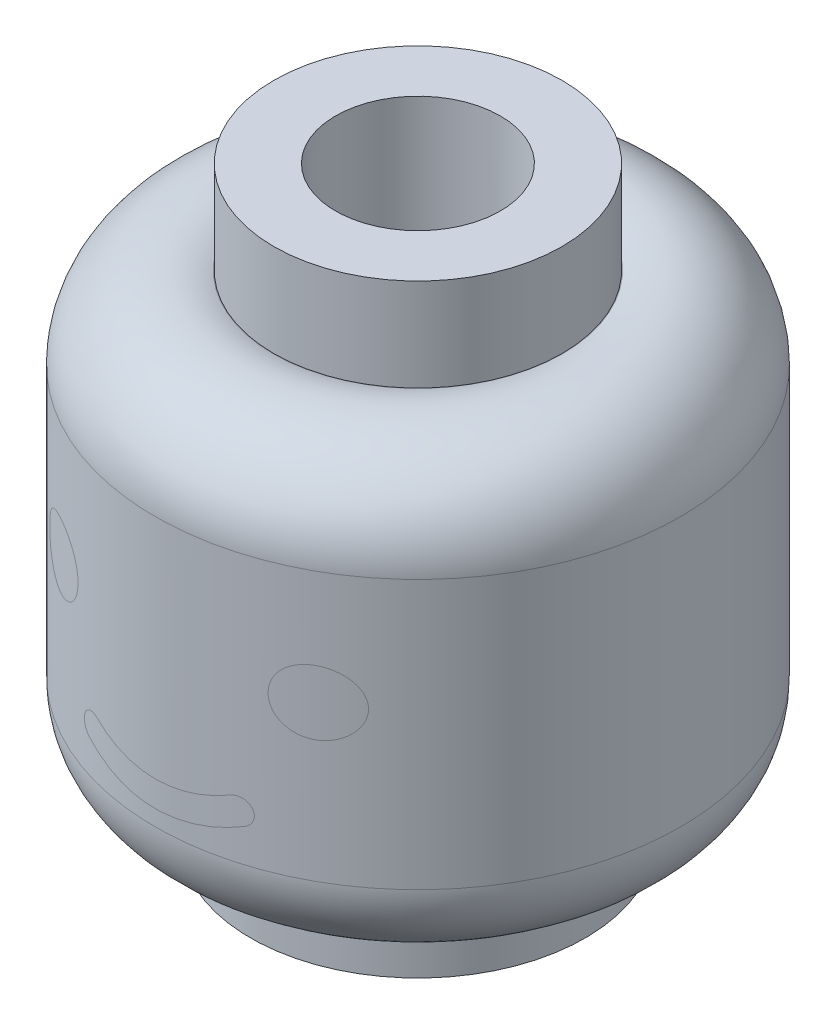
from build123d import *

# Parameters (mm, degrees)
CUT_EXTRUDE1_DEPTH = 10
CIRPATTERN1_COUNT  = 3


with BuildPart() as part:
    # Sketch1 → Head Revolve (revolve)
    with BuildSketch(Plane.XY, mode=Mode.PRIVATE) as head_revolve_sk:
        with BuildLine():
            Line((0, 8.861467442), (0, 9.761467442))
            Line((0, 9.761467442), (1.6, 9.761467442))
            Line((1.6, 9.761467442), (1.6, 11.761467442))
            Line((1.6, 11.761467442), (2.796868049, 11.761467442))
            Line((2.796868049, 11.761467442), (2.796868049, 9.961467442))
            Line((2.796868049, 9.961467442), (2.809886353, 9.966286057))
            ThreePointArc((2.809886353, 9.966286057), (4.371289555, 9.767199261), (5.1, 8.371994401))
            Line((5.1, 8.371994401), (5.1, 3.155002023))
            ThreePointArc((5.1, 3.155002023), (4.556524041, 1.909027648), (3.273585714, 1.459708707))
            Line((3.273585714, 1.459708707), (3.25, 1.461467442))
            Line((3.25, 1.461467442), (3.25, 0.361467442))
            Line((3.25, 0.361467442), (2.45, 0.361467442))
            Line((2.45, 0.361467442), (2.45, 8.861467442))
            Line((2.45, 8.861467442), (0, 8.861467442))
        make_face()
    revolve(head_revolve_sk.sketch.rotate(Axis((0, 0, 0), (0, 1, 0)), 90), axis=Axis((0, 0, 0), (0, 1, 0)))

    # Sketch2 → Cut-Extrude1 (cut)
    with BuildSketch(Plane(origin=(0, 9.761467442, 0), x_dir=(1, 0, 0), z_dir=(0, 1, 0))):
        with BuildLine():
            Line((-0.42, 1.543891188), (-0.42, 0.242487113))
            Line((-0.42, 0.242487113), (-1.547048989, -0.408214924))
            ThreePointArc((-1.547048989, -0.408214924), (-1.385640646, 0.8), (-0.42, 1.543891188))
        make_face()
    cut_extrude1 = extrude(amount=-CUT_EXTRUDE1_DEPTH, mode=Mode.SUBTRACT)

    # CirPattern1: Cut-Extrude1 ×3 about axis
    cirpattern1_axis = Axis((0, 0, 0), (0, 1, 0))
    for i in range(1, CIRPATTERN1_COUNT):
        add(cut_extrude1.rotate(cirpattern1_axis, i * 360 / CIRPATTERN1_COUNT), mode=Mode.SUBTRACT)


solid = part.part
